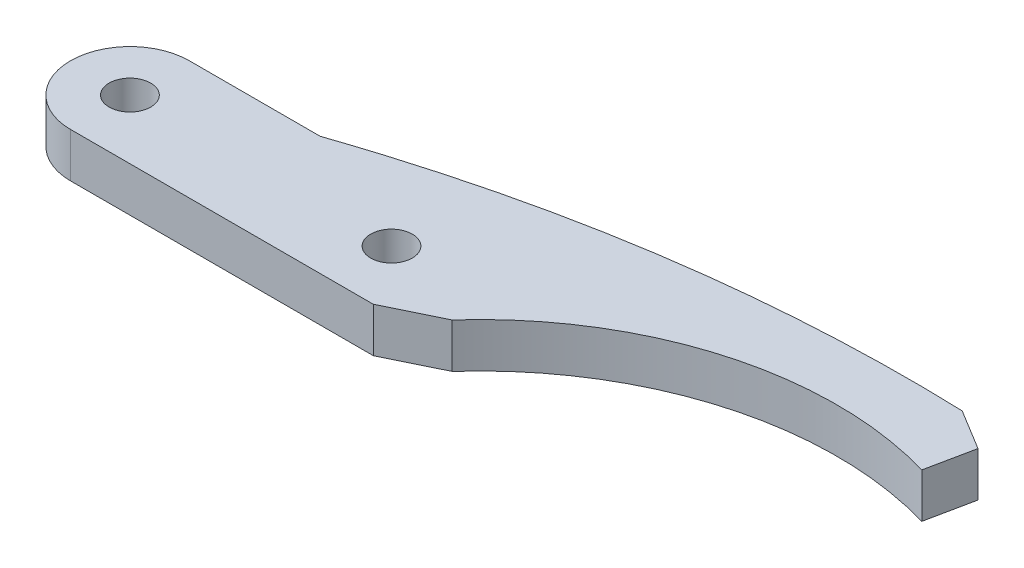
from build123d import *

# Parameters (mm, degrees)
SKETCH_1_R          = 20
SKETCH_1_R_2        = 7
EXTRUDE_1_DEPTH     = 10
EXTRUDE_START       = -10
EXTRUDE_2_DEPTH     = 10
SKETCH_3_R          = 7
EXTRUDE_3_DEPTH     = 10
CUT_EXTRUDE_START   = -5
SKETCH_4_R          = 7
CUT_EXTRUDE_1_DEPTH = 5


with BuildPart() as part:
    # 草图1 → 凸台-拉伸1 (new body)
    # profile 1 of 3: a face of its own
    with BuildSketch(Plane(origin=(0, 0, 0), x_dir=(1, 0, 0), z_dir=(0, 1, 0))):
        Circle(SKETCH_1_R)
        with Locations(Location((0, 0, 0), (0, 0, 270))):
            Circle(SKETCH_1_R_2, mode=Mode.SUBTRACT)
    # profile 2 of 3: a face of its own
    with BuildSketch(Plane(origin=(0, 0, 0), x_dir=(1, 0, 0), z_dir=(0, 1, 0))):
        with BuildLine():
            Line((0, -20), (88, -20))
            ThreePointArc((88, -20), (68, 0), (88, 20))
            Line((88, 20), (-1.4e-08, 20))
            ThreePointArc((-1.4e-08, 20), (14.142135619, 14.142135629), (20, 0))
            ThreePointArc((20, 0), (14.142135624, -14.142135624), (0, -20))
        make_face()
    # profile 3 of 3: a face of its own
    with BuildSketch(Plane(origin=(0, 0, 0), x_dir=(1, 0, 0), z_dir=(0, 1, 0))):
        with Locations((88, 0)):
            Circle(SKETCH_1_R)
        with Locations(Location((88, 0, 0), (0, 0, 270))):
            Circle(SKETCH_1_R_2, mode=Mode.SUBTRACT)
    extrude(amount=EXTRUDE_1_DEPTH)

    # 草图2 → 凸台-拉伸2 (add)
    with BuildSketch(Plane(origin=(0, 10, 0), x_dir=(1, 0, 0), z_dir=(0, 1, 0)).offset(EXTRUDE_START)):
        with BuildLine():
            Line((88, -20), (101.910822615, -20))
            Line((101.910822615, -20), (119.744098688, -11.302130098))
            ThreePointArc((119.744098688, -11.302130098), (175.999613382, 24.015412746), (242.422587784, 24))
            Line((242.422587784, 24), (245.659989933, 39.669053173))
            Line((245.659989933, 39.669053173), (232, 48))
            add(Edge.make_bspline(
                [(44, 20), (135.765778064, 51.236254285), (232, 48)],
                knots=[0, 0, 0, 1, 1, 1], degree=2))
            Line((44, 20), (88, 20))
            ThreePointArc((88, 20), (108, 0), (88, -20))
        make_face()
    extrude(amount=EXTRUDE_2_DEPTH)

    # 草图3 → 凸台-拉伸3 (add)
    with BuildSketch(Plane(origin=(0, 10, 0), x_dir=(1, 0, 0), z_dir=(0, 1, 0))):
        with BuildLine():
            Line((245.659989933, 39.669053173), (232, 48))
            add(Edge.make_bspline(
                [(232, 48), (135.765778064, 51.236254285), (44, 20)],
                knots=[0, 0, 0, 1, 1, 1], degree=2))
            Line((44, 20), (0, 20))
            ThreePointArc((0, 20), (-20, 0), (0, -20))
            Line((0, -20), (101.910822615, -20))
            Line((101.910822615, -20), (119.744098688, -11.302130098))
            ThreePointArc((119.744098688, -11.302130098), (175.999613382, 24.015412746), (242.422587784, 24))
            Line((242.422587784, 24), (245.659989933, 39.669053173))
        make_face()
        with Locations(Location((88, 0, 0), (0, 0, 270))):
            Circle(SKETCH_3_R, mode=Mode.SUBTRACT)
        with Locations(Location((0, 0, 0), (0, 0, 270))):
            Circle(SKETCH_3_R, mode=Mode.SUBTRACT)
    extrude(amount=EXTRUDE_3_DEPTH)

    # 草图4 → 切除-拉伸1 (cut)
    with BuildSketch(Plane(origin=(0, 20, 0), x_dir=(1, 0, 0), z_dir=(0, 1, 0)).offset(CUT_EXTRUDE_START)):
        with BuildLine():
            Line((242.422587784, 24), (245.659989933, 39.669053173))
            Line((245.659989933, 39.669053173), (232, 48))
            add(Edge.make_bspline(
                [(232, 48), (135.765778061, 51.236254285), (43.999999994, 19.999999998)],
                knots=[0, 0, 0, 1, 1, 1], degree=2))
            Line((43.999999994, 19.999999998), (0, 20))
            ThreePointArc((0, 20), (-20, 0), (0, -20))
            Line((0, -20), (101.910822615, -20))
            Line((101.910822615, -20), (119.744098688, -11.302130098))
            ThreePointArc((119.744098688, -11.302130098), (175.999613382, 24.015412746), (242.422587784, 24))
        make_face()
        with Locations(Location((0, 0, 0), (0, 0, 270))):
            Circle(SKETCH_4_R, mode=Mode.SUBTRACT)
        with Locations(Location((88, 0, 0), (0, 0, 270))):
            Circle(SKETCH_4_R, mode=Mode.SUBTRACT)
    extrude(amount=CUT_EXTRUDE_1_DEPTH, mode=Mode.SUBTRACT)


solid = part.part
